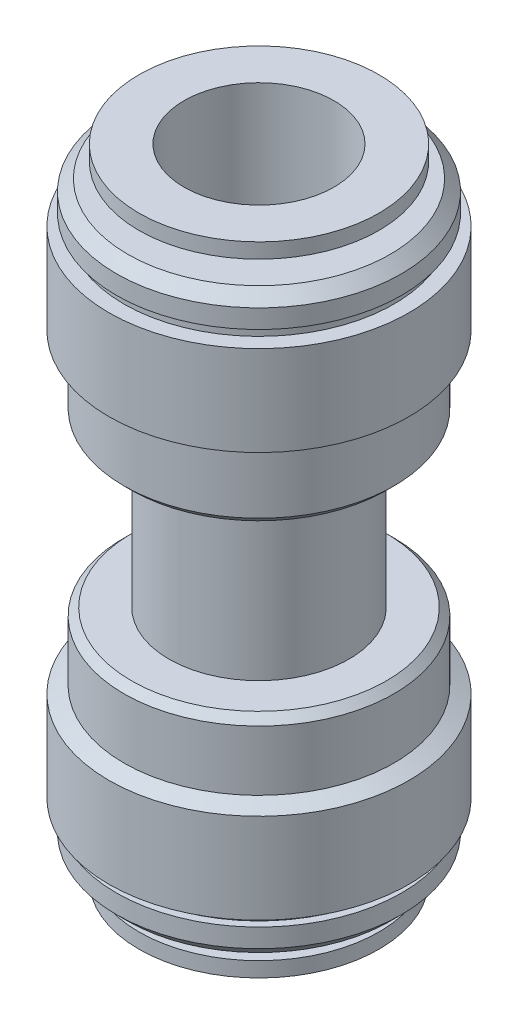
from build123d import *

# Parameters (mm, degrees)
SKETCH_2_R          = 5
CUT_EXTRUDE_1_DEPTH = 60


with BuildPart() as part:
    # Эскиз1 → Повернуть1 (revolve)
    with BuildSketch(Plane.XY, mode=Mode.PRIVATE) as revolve_1_sk:
        Polygon((8, 1), (6, 1), (6, 2), (8.75, 2), (9.5, 2.75), (9.5, 4), (9, 4), (9, 4.75), (10, 4.75), (10, 10.75), (9, 11.25), (9, 15.25), (8.5, 15.75), (6, 15.75), (6, 26.75), (8.5, 26.75), (9, 27.25), (9, 31.25), (10, 31.75), (10, 37.75), (9, 37.75), (9, 38.5), (9.5, 38.5), (9.5, 39.75), (8.75, 40.5), (6, 40.5), (6, 41.5), (8, 41.5), (8, 42.5), (0, 42.5), (0, 0), (8, 0), align=None)
    revolve(revolve_1_sk.sketch.rotate(Axis((0, 136.374036199, 0), (0, -1, 0)), 90), axis=Axis((0, 136.374036199, 0), (0, -1, 0)))

    # Эскиз2 → Вырез-Вытянуть1 (cut)
    with BuildSketch(Plane(origin=(0, 42.5, 0), x_dir=(1, 0, 0), z_dir=(0, 1, 0))):
        with Locations(Location((0, 0, 0), (0, 0, 270))):
            Circle(SKETCH_2_R)
    extrude(amount=-CUT_EXTRUDE_1_DEPTH, mode=Mode.SUBTRACT)


solid = part.part
